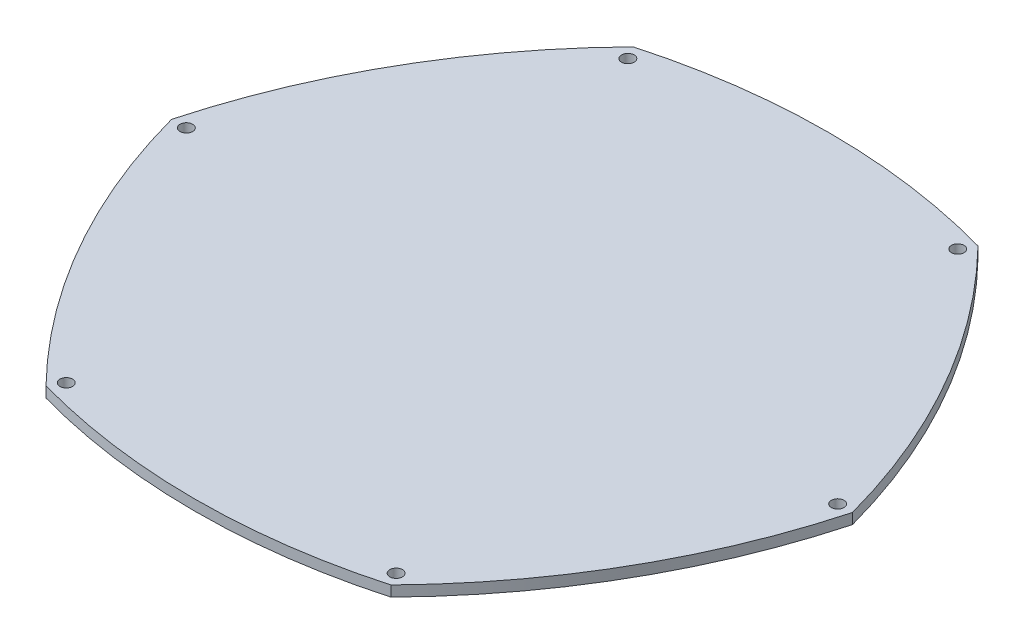
from build123d import *

# Parameters (mm, degrees)
SKETCH1_R           = 75
SKETCH1_R_2         = 73.5
SKETCH1_R_3         = 1.5
BOSS_EXTRUDE1_DEPTH = 2.5


with BuildPart() as part:
    # Sketch1 → Boss-Extrude1 (new body)
    # profile 1 of 8: a face of its own
    with BuildSketch(Plane(origin=(0, 0, 0), x_dir=(1, 0, 0), z_dir=(0, 1, 0))):
        Circle(SKETCH1_R)
        Circle(SKETCH1_R_2, mode=Mode.SUBTRACT)
    # profile 2 of 8: a face of its own
    with BuildSketch(Plane(origin=(0, 0, 0), x_dir=(1, 0, 0), z_dir=(0, 1, 0))):
        Circle(SKETCH1_R_2)
    # profile 3 of 8: a face of its own
    with BuildSketch(Plane(origin=(0, 0, 0), x_dir=(1, 0, 0), z_dir=(0, 1, 0))):
        with BuildLine():
            ThreePointArc((-65.092339325, -37.255702398), (-75, -1.885e-06), (-65.092341198, 37.255699125))
            ThreePointArc((-65.092341198, 37.255699125), (-73.987141009, 19.120393419), (-80.5, 0))
            ThreePointArc((-80.5, 0), (-73.987140288, -19.120395161), (-65.092339325, -37.255702398))
        make_face()
        with Locations(Location((-77, 0, 0), (0, 0, 270))):
            Circle(SKETCH1_R_3, mode=Mode.SUBTRACT)
    # profile 4 of 8: a face of its own
    with BuildSketch(Plane(origin=(0, 0, 0), x_dir=(1, 0, 0), z_dir=(0, 1, 0))):
        with BuildLine():
            ThreePointArc((-40.772727273, -69.410623904), (-20.577028262, -73.596152049), (5.64e-07, -75))
            ThreePointArc((5.64e-07, -75), (-37.621950265, -64.881344455), (-65.092339325, -37.255702398))
            ThreePointArc((-65.092339325, -37.255702398), (-53.960444579, -54.110599462), (-40.772727273, -69.410623904))
        make_face()
        with Locations(Location((-39, -66.392770691, 0), (0, 0, 270))):
            Circle(SKETCH1_R_3, mode=Mode.SUBTRACT)
    # profile 5 of 8: a face of its own
    with BuildSketch(Plane(origin=(0, 0, 0), x_dir=(1, 0, 0), z_dir=(0, 1, 0))):
        with BuildLine():
            ThreePointArc((40.772727273, -69.410623904), (53.960444658, -54.110599358), (65.092339455, -37.255702172))
            ThreePointArc((65.092339455, -37.255702172), (37.621950865, -64.881344107), (5.64e-07, -75))
            ThreePointArc((5.64e-07, -75), (20.577028821, -73.596151973), (40.772727273, -69.410623904))
        make_face()
        with Locations(Location((39, -66.392770691, 0), (0, 0, 270))):
            Circle(SKETCH1_R_3, mode=Mode.SUBTRACT)
    # profile 6 of 8: a face of its own
    with BuildSketch(Plane(origin=(0, 0, 0), x_dir=(1, 0, 0), z_dir=(0, 1, 0))):
        with BuildLine():
            ThreePointArc((65.092339583, 37.255701948), (72.480774929, 19.27530196), (75, 0))
            ThreePointArc((75, 0), (72.480774896, -19.275302084), (65.092339455, -37.255702172))
            ThreePointArc((65.092339455, -37.255702172), (73.987140338, -19.120395041), (80.5, 0))
            ThreePointArc((80.5, 0), (73.987140387, 19.120394921), (65.092339583, 37.255701948))
        make_face()
        with Locations(Location((77, 0, 0), (0, 0, 270))):
            Circle(SKETCH1_R_3, mode=Mode.SUBTRACT)
    # profile 7 of 8: a face of its own
    with BuildSketch(Plane(origin=(0, 0, 0), x_dir=(1, 0, 0), z_dir=(0, 1, 0))):
        with BuildLine():
            ThreePointArc((-4.58e-07, 75), (37.621950535, 64.881344298), (65.092339583, 37.255701948))
            ThreePointArc((65.092339583, 37.255701948), (53.960444736, 54.110599255), (40.772727273, 69.410623904))
            ThreePointArc((40.772727273, 69.410623904), (20.577028315, 73.596152042), (-4.58e-07, 75))
        make_face()
        with Locations(Location((39, 66.392770691, 0), (0, 0, 270))):
            Circle(SKETCH1_R_3, mode=Mode.SUBTRACT)
    # profile 8 of 8: a face of its own
    with BuildSketch(Plane(origin=(0, 0, 0), x_dir=(1, 0, 0), z_dir=(0, 1, 0))):
        with BuildLine():
            ThreePointArc((-65.092341198, 37.255699125), (-37.621952338, 64.881343253), (-4.58e-07, 75))
            ThreePointArc((-4.58e-07, 75), (-20.577028768, 73.59615198), (-40.772727273, 69.410623904))
            ThreePointArc((-40.772727273, 69.410623904), (-53.960445716, 54.110597958), (-65.092341198, 37.255699125))
        make_face()
        with Locations(Location((-39, 66.392770691, 0), (0, 0, 270))):
            Circle(SKETCH1_R_3, mode=Mode.SUBTRACT)
    extrude(amount=BOSS_EXTRUDE1_DEPTH)


solid = part.part
